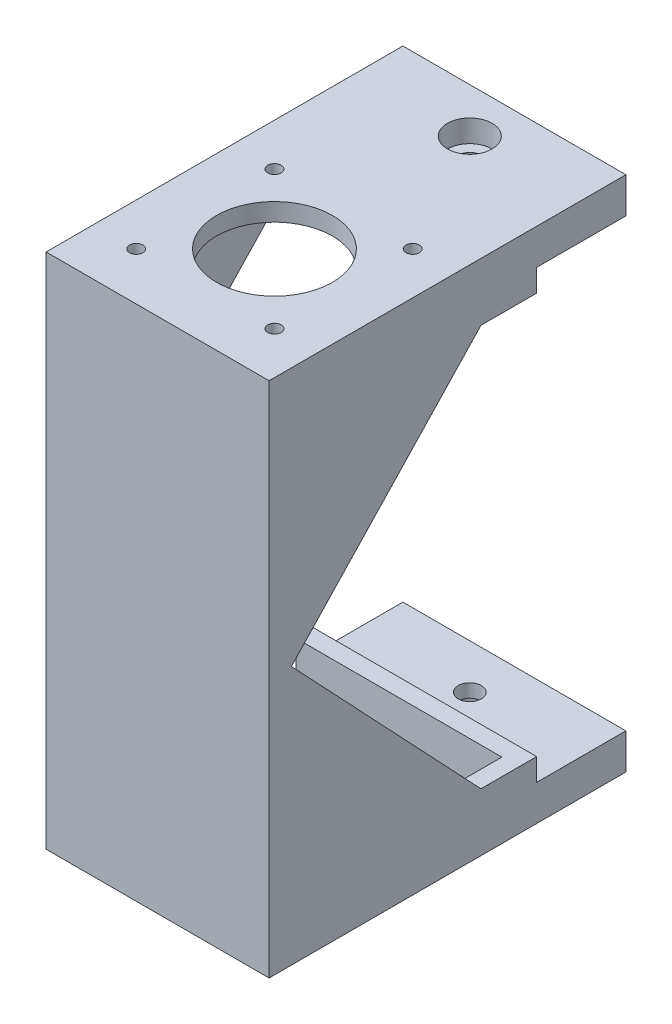
from build123d import *

# Parameters (mm, degrees)
SKETCH_1_W          = 50
SKETCH_1_H          = 20
EXTRUDE_1_DEPTH     = 8
SKETCH_2_W          = 50
SKETCH_2_H          = 4
EXTRUDE_2_DEPTH     = 13
SKETCH_3_W          = 50
SKETCH_3_H          = 60
EXTRUDE_3_DEPTH     = 4
SKETCH_4_W          = 50
SKETCH_4_H          = 5
EXTRUDE_4_DEPTH     = 40
EXTRUDE_5_DEPTH     = 50
SKETCH_7_W          = 4
SKETCH_7_H          = 5
CUT_EXTRUDE_1_DEPTH = 50
EXTRUDE_7_DEPTH     = 3.8
EXTRUDE_8_DEPTH     = 3.8
SKETCH_11_R         = 1.5
SKETCH_11_R_2       = 13
CUT_EXTRUDE_2_DEPTH = 4
SKETCH_14_W         = 4
SKETCH_14_H         = 5
EXTRUDE_9_DEPTH     = 50
CUT_EXTRUDE_3_DEPTH = 50
CUT_EXTRUDE_START   = -200
SKETCH_16_R         = 2.6
CUT_EXTRUDE_4_DEPTH = 200
SKETCH_17_R         = 5
CUT_EXTRUDE_5_DEPTH = 5
CUT_EXTRUDE_START_2 = -5
SKETCH_18_R         = 5
CUT_EXTRUDE_6_DEPTH = 5
SKETCH_19_W         = 50
SKETCH_19_H         = 4
CUT_EXTRUDE_7_DEPTH = 20
SKETCH_20_W         = 50
SKETCH_20_H         = 4
CUT_EXTRUDE_8_DEPTH = 20


with BuildPart() as part:
    # 草图1 → 凸台-拉伸1 (new body)
    with BuildSketch(Plane(origin=(0, 0, 0), x_dir=(1, 0, 0), z_dir=(0, 1, 0))):
        with Locations((25, -10)):
            Rectangle(SKETCH_1_W, SKETCH_1_H)
    extrude(amount=EXTRUDE_1_DEPTH)

    # 草图2 → 凸台-拉伸2 (add)
    with BuildSketch(Plane(origin=(0, 8, 0), x_dir=(1, 0, 0), z_dir=(0, 1, 0))):
        with Locations((25, 2)):
            Rectangle(SKETCH_2_W, SKETCH_2_H)
        with Locations((25, -22)):
            Rectangle(SKETCH_2_W, SKETCH_2_H)
    extrude(amount=-EXTRUDE_2_DEPTH)

    # 草图3 → 凸台-拉伸3 (add)
    with BuildSketch(Plane(origin=(0, 8, 0), x_dir=(1, 0, 0), z_dir=(0, 1, 0))):
        with Locations((25, -50)):
            Rectangle(SKETCH_3_W, SKETCH_3_H)
    extrude(amount=-EXTRUDE_3_DEPTH)

    # 草图4 → 凸台-拉伸4 (add)
    with BuildSketch(Plane.XZ.offset(-4)):
        with Locations((25, 77.5)):
            Rectangle(SKETCH_4_W, SKETCH_4_H)
    extrude(amount=EXTRUDE_4_DEPTH)

    # 草图6 → 凸台-拉伸5 (add)
    with BuildSketch(Plane.ZY):
        Polygon((20, -100), (-4, -100), (-4, -108), (80, -108), (80, -36), (75, -36), (75, -104), (24, -104), (24, -95), (20, -95), align=None)
    extrude(amount=-EXTRUDE_5_DEPTH)

    # 草图7 → 切除-拉伸1 (cut)
    with BuildSketch(Plane.ZY):
        with Locations((-2, -2.5)):
            Rectangle(SKETCH_7_W, SKETCH_7_H)
    extrude(amount=-CUT_EXTRUDE_1_DEPTH, mode=Mode.SUBTRACT)

    # 草图8 → 凸台-拉伸7 (add)
    with BuildSketch(Plane.ZY):
        Polygon((75, -50), (75, 4), (24, 4), (24, -5), (32.5, -5), align=None)
    extrude(amount=-EXTRUDE_7_DEPTH)

    # 草图9 → 凸台-拉伸8 (add)
    with BuildSketch(Plane(origin=(50, 0, 0), x_dir=(0, 0, -1), z_dir=(1, 0, 0))):
        Polygon((-24, -5), (-24, 4), (-75, 4), (-75, -50), (-32.5, -5), align=None)
        Polygon((-32.5, -95), (-75, -50), (-75, -104), (-24, -104), (-24, -95), align=None)
    extrude(amount=-EXTRUDE_8_DEPTH)

    # 草图11 → 切除-拉伸2 (cut)
    with BuildSketch(Plane(origin=(0, 4, 0), x_dir=(-1, 0, 0), z_dir=(0, -1, 0))):
        with Locations(Location((-40.5, -38.3, 0), (0, 0, 90))):
            Circle(SKETCH_11_R)
        with Locations(Location((-9.5, -38.3, 0), (0, 0, 90))):
            Circle(SKETCH_11_R)
        with Locations(Location((-40.5, -69.3, 0), (0, 0, 90))):
            Circle(SKETCH_11_R)
        with Locations(Location((-9.5, -69.3, 0), (0, 0, 90))):
            Circle(SKETCH_11_R)
        with Locations(Location((-25, -53.8, 0), (0, 0, 90))):
            Circle(SKETCH_11_R_2)
    extrude(amount=-CUT_EXTRUDE_2_DEPTH, mode=Mode.SUBTRACT)

    # 草图14 → 凸台-拉伸9 (add)
    with BuildSketch(Plane.ZY):
        with Locations((-2, -97.5)):
            Rectangle(SKETCH_14_W, SKETCH_14_H)
        with Locations((-2, -2.5)):
            Rectangle(SKETCH_14_W, SKETCH_14_H)
    extrude(amount=-EXTRUDE_9_DEPTH)

    # 草图15 → 切除-拉伸3 (cut)
    with BuildSketch(Plane.XZ):
        with BuildLine():
            ThreePointArc((27.6, 10), (25.491679555, 12.553086606), (22.585960604, 10.965615759))
            Line((22.585960604, 10.965615759), (27.414039396, 9.034384241))
            ThreePointArc((27.414039396, 9.034384241), (27.553086606, 9.508320445), (27.6, 10))
        make_face()
        with BuildLine():
            Line((27.414039396, 9.034384241), (22.585960604, 10.965615759))
            ThreePointArc((22.585960604, 10.965615759), (24.034384241, 7.585960604), (27.414039396, 9.034384241))
        make_face()
    extrude(amount=-CUT_EXTRUDE_3_DEPTH, mode=Mode.SUBTRACT)

    # 草图16 → 切除-拉伸4 (cut)
    with BuildSketch(Plane(origin=(0, 8, 0), x_dir=(1, 0, 0), z_dir=(0, 1, 0)).offset(CUT_EXTRUDE_START)):
        with Locations(Location((25, -10, 0), (0, 0, 90))):
            Circle(SKETCH_16_R)
    extrude(amount=CUT_EXTRUDE_4_DEPTH, mode=Mode.SUBTRACT)

    # 草图17 → 切除-拉伸5 (cut)
    with BuildSketch(Plane(origin=(0, 8, 0), x_dir=(1, 0, 0), z_dir=(0, 1, 0))):
        with Locations(Location((25, -10, 0), (0, 0, 270))):
            Circle(SKETCH_17_R)
    extrude(amount=-CUT_EXTRUDE_5_DEPTH, mode=Mode.SUBTRACT)

    # 草图18 → 切除-拉伸6 (cut)
    with BuildSketch(Plane.XZ.offset(108).offset(CUT_EXTRUDE_START_2)):
        with Locations(Location((25, 10, 0), (0, 0, 90))):
            Circle(SKETCH_18_R)
    extrude(amount=CUT_EXTRUDE_6_DEPTH, mode=Mode.SUBTRACT)

    # 草图19 → 切除-拉伸7 (cut)
    with BuildSketch(Plane(origin=(0, -5, 0), x_dir=(-1, 0, 0), z_dir=(0, -1, 0))):
        with Locations((-25, 2)):
            Rectangle(SKETCH_19_W, SKETCH_19_H)
    extrude(amount=-CUT_EXTRUDE_7_DEPTH, mode=Mode.SUBTRACT)

    # 草图20 → 切除-拉伸8 (cut)
    with BuildSketch(Plane(origin=(0, -95, 0), x_dir=(1, 0, 0), z_dir=(0, 1, 0))):
        with Locations((25, 2)):
            Rectangle(SKETCH_20_W, SKETCH_20_H)
    extrude(amount=-CUT_EXTRUDE_8_DEPTH, mode=Mode.SUBTRACT)


solid = part.part
